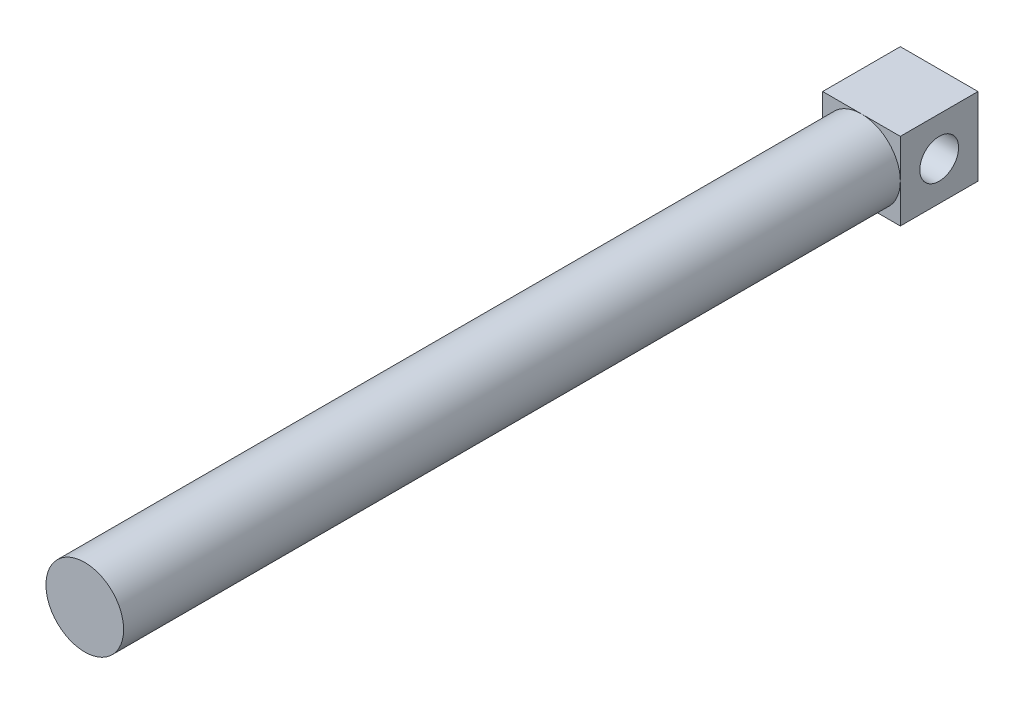
from build123d import *

# Parameters (mm, degrees)
SKETCH_1_R          = 5
EXTRUDE_1_DEPTH     = 100
SKETCH_2_W          = 10
SKETCH_2_H          = 10
EXTRUDE_2_DEPTH     = 10
SKETCH_3_R          = 2.5
CUT_EXTRUDE_1_DEPTH = 101.623058987


with BuildPart() as part:
    # 草图1 → 凸台-拉伸1 (new body)
    with BuildSketch(Plane.XY):
        Circle(SKETCH_1_R)
    extrude(amount=EXTRUDE_1_DEPTH)

    # 草图2 → 凸台-拉伸2 (add)
    with BuildSketch(Plane(origin=(0, 0, 0), x_dir=(-1, 0, 0), z_dir=(0, 0, -1))):
        Rectangle(SKETCH_2_W, SKETCH_2_H)
    extrude(amount=EXTRUDE_2_DEPTH)

    # 草图3 → 切除-拉伸1 (cut, through all)
    with BuildSketch(Plane(origin=(5, 0, 0), x_dir=(0, 0, -1), z_dir=(1, 0, 0))):
        with Locations((5, 0)):
            Circle(SKETCH_3_R)
    extrude(amount=-CUT_EXTRUDE_1_DEPTH, mode=Mode.SUBTRACT)


solid = part.part
